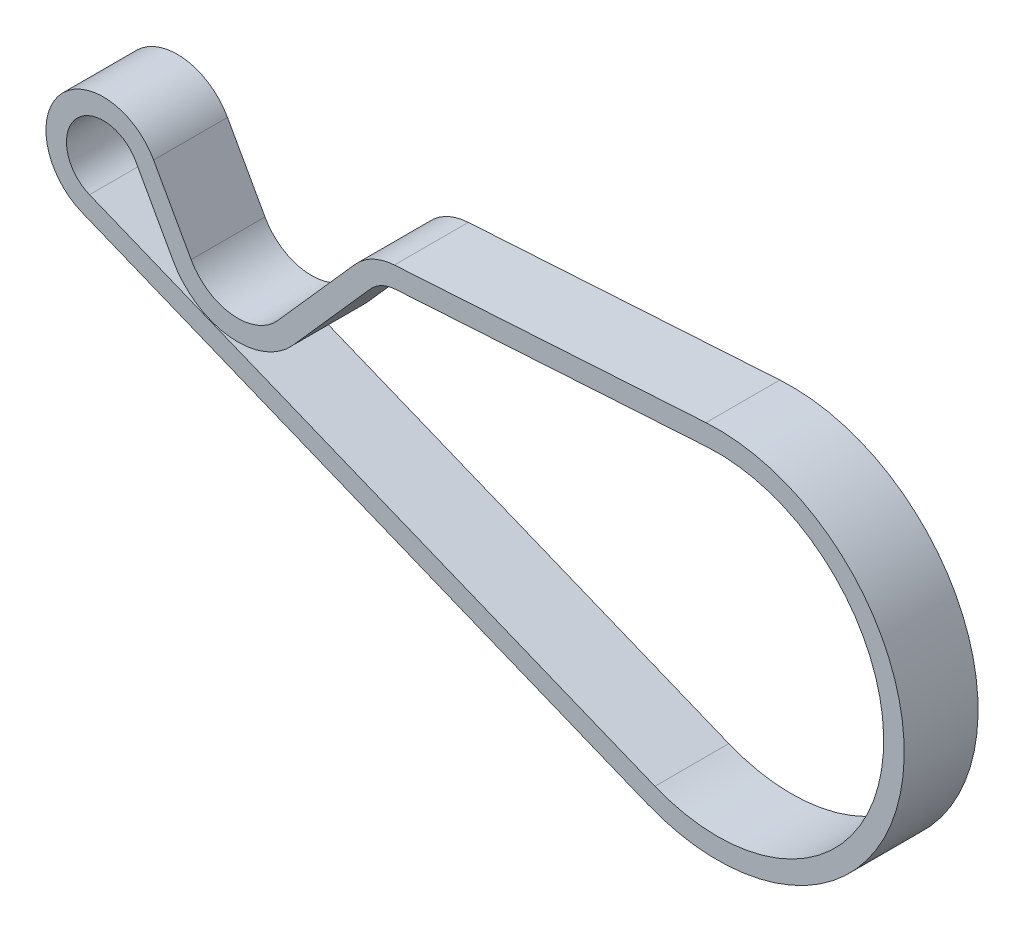
from build123d import *

# Parameters (mm, degrees)
EXTRUDE_THIN1_DEPTH      = 28
EXTRUDE_THIN1_DEPTH_BACK = 8


with BuildPart() as part:
    # Sketch1 → Extrude-Thin1 (new, two sides: drawn at the far end of the back side and taken through both)
    with BuildSketch(Plane.XY.offset(-EXTRUDE_THIN1_DEPTH_BACK)):
        with BuildLine():
            Line((19.383566169, -68.309294305), (57.022380557, -25.814786092))
            ThreePointArc((57.022380557, -25.814786092), (65.70728891, -19.214238602), (76.255341013, -16.4333292))
            Line((76.255341013, -16.4333292), (228.091165061, -7.048771065))
            ThreePointArc((228.091165061, -7.048771065), (323.514042398, -112.549255422), (199.474713255, -182.192076622))
            Line((199.474713255, -182.192076622), (-76.082369589, -70.323577063))
            ThreePointArc((-76.082369589, -70.323577063), (-86.509762237, -25.814215154), (-41.067256055, -30.793416585))
            Line((-41.067256055, -30.793416585), (-22.813516306, -63.686280276))
            ThreePointArc((-22.813516306, -63.686280276), (-2.911096467, -76.915520396), (19.383566169, -68.309294305))
        make_face()
        with BuildLine():
            Line((26.869376151, -74.939727844), (64.508190539, -32.44521963))
            ThreePointArc((64.508190539, -32.44521963), (70.091345909, -28.20201053), (76.872236546, -26.414283057))
            Line((76.872236546, -26.414283057), (228.708060595, -17.029724922))
            ThreePointArc((228.708060595, -17.029724922), (313.644907456, -110.93674946), (203.236273822, -172.926513385))
            Line((203.236273822, -172.926513385), (-72.320809021, -61.058013827))
            ThreePointArc((-72.320809021, -61.058013827), (-79.024132867, -32.444852599), (-49.811093178, -35.645767804))
            Line((-49.811093178, -35.645767804), (-31.557353429, -68.538631496))
            ThreePointArc((-31.557353429, -68.538631496), (-4.00015673, -86.856040893), (26.869376151, -74.939727844))
        make_face(mode=Mode.SUBTRACT)
    extrude(amount=EXTRUDE_THIN1_DEPTH + EXTRUDE_THIN1_DEPTH_BACK)


solid = part.part
